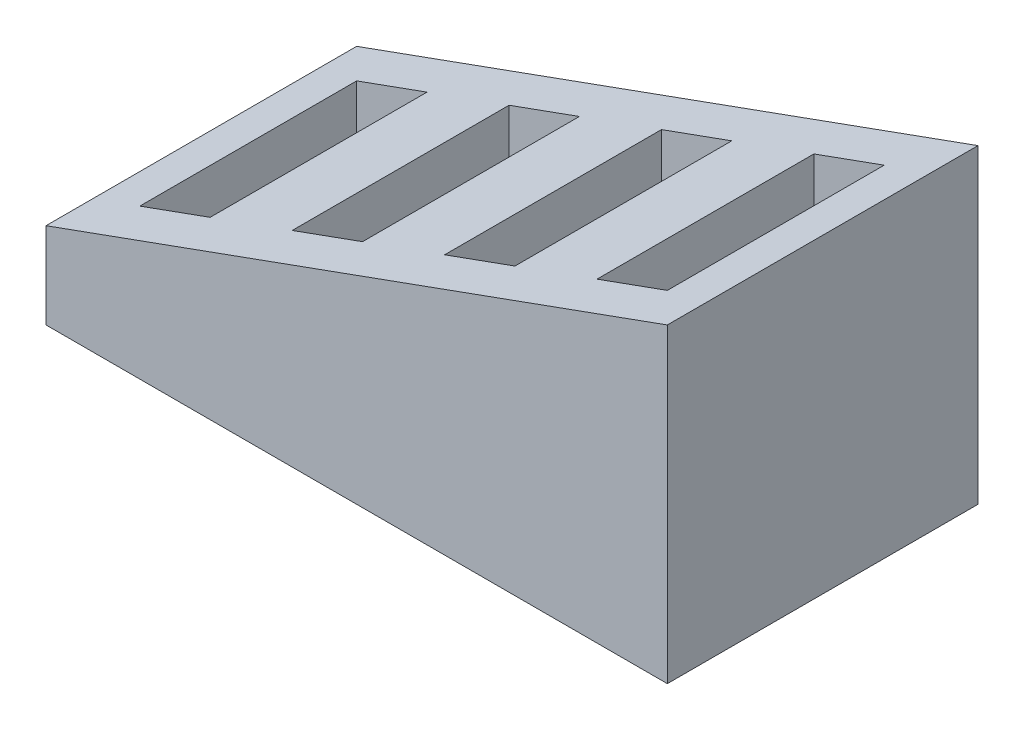
from build123d import *

# Parameters (mm, degrees)
BOSS_EXTRUDE1_DEPTH = 7.95
SHELL1_T            = -1.2
SKETCH2_W           = 1.8
SKETCH2_H           = 5.55
CUT_EXTRUDE1_DEPTH  = 20.473443455
LPATTERN1_COUNT     = 4
LPATTERN1_PITCH     = 3.9


with BuildPart() as part:
    # Sketch1 → Boss-Extrude1 (new body)
    with BuildSketch(Plane.XY):
        Polygon((0, 0), (-15.9, 0), (-15.9, 2.2), (0, 7.95), align=None)
    extrude(amount=-BOSS_EXTRUDE1_DEPTH)

    # Shell1
    shell1_openings = [part.faces().sort_by_distance(p)[0] for p in [
        (-7.95, 0, -3.975),
    ]]
    offset(amount=SHELL1_T, openings=shell1_openings, kind=Kind.INTERSECTION)

    # Sketch2 → Cut-Extrude1 (cut, through all)
    with BuildSketch(Plane.XZ):
        with Locations((-13.8, -3.975)):
            Rectangle(SKETCH2_W, SKETCH2_H)
    cut_extrude1 = extrude(amount=-CUT_EXTRUDE1_DEPTH, mode=Mode.SUBTRACT)

    # LPattern1: Cut-Extrude1 ×4
    with Locations(*[(i * LPATTERN1_PITCH, 0, 0) for i in range(1, LPATTERN1_COUNT)]):
        add(cut_extrude1, mode=Mode.SUBTRACT)


solid = part.part
